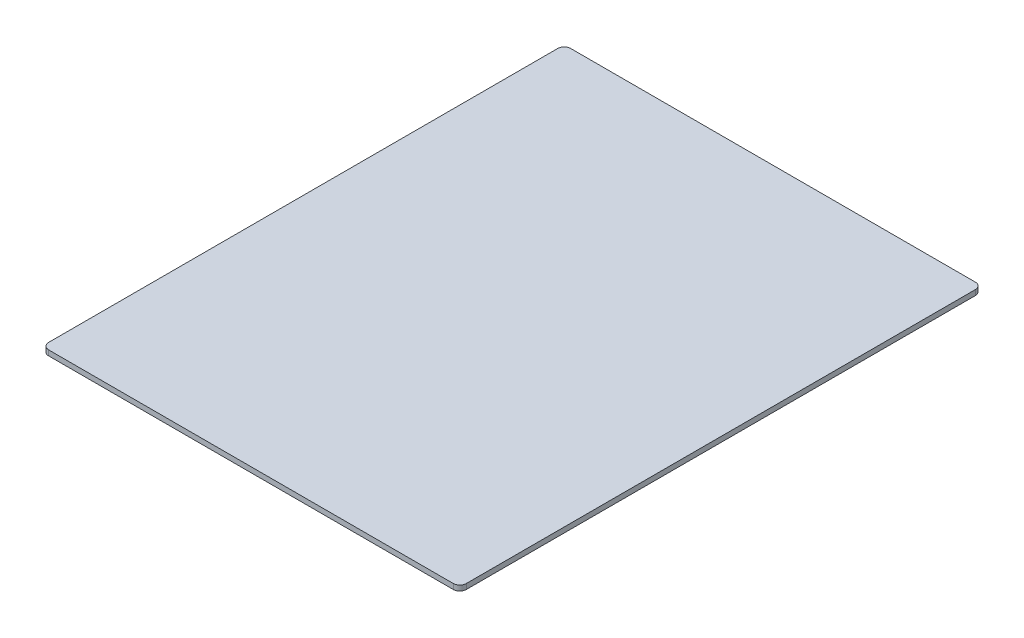
from build123d import *

# Parameters (mm, degrees)
SKETCH1_W           = 160
SKETCH1_H           = 200
BOSS_EXTRUDE1_DEPTH = 2
FILLET1_R           = 2.5


with BuildPart() as part:
    # Sketch1 → Boss-Extrude1 (new body)
    with BuildSketch(Plane(origin=(0, 0, 0), x_dir=(1, 0, 0), z_dir=(0, 1, 0))):
        Rectangle(SKETCH1_W, SKETCH1_H)
    extrude(amount=BOSS_EXTRUDE1_DEPTH)

    # Fillet1
    fillet1_edges = [part.edges().sort_by_distance(p)[0] for p in [
        (-80, 1, -100),
        (80, 1, -100),
        (80, 1, 100),
        (-80, 1, 100),
    ]]
    fillet(fillet1_edges, radius=FILLET1_R)


solid = part.part
